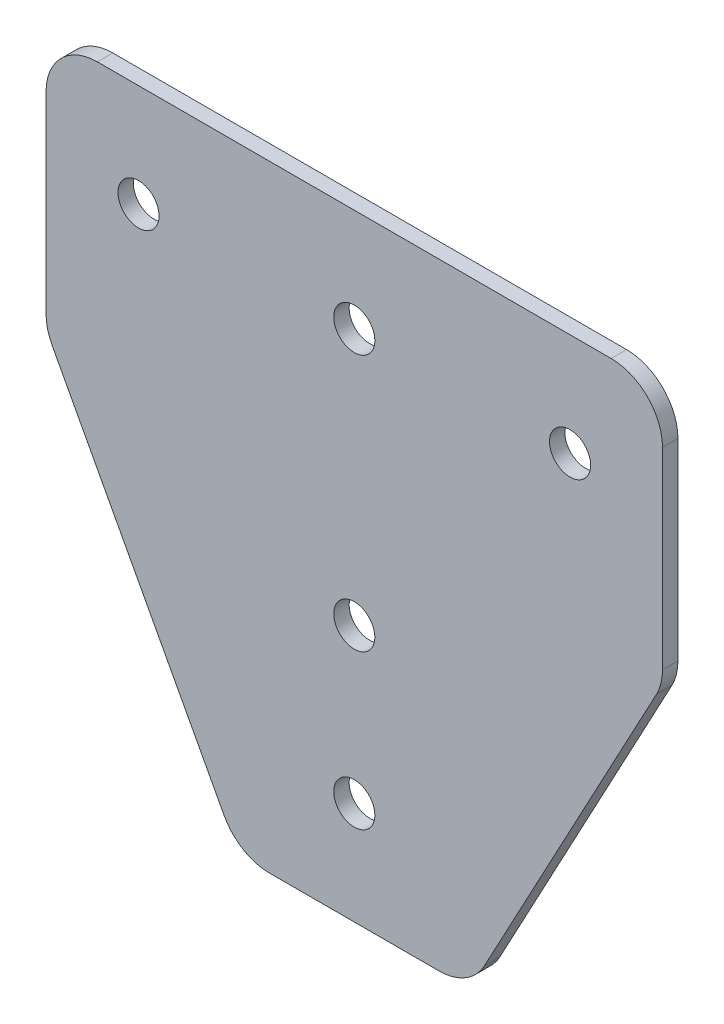
from build123d import *

# Parameters (mm, degrees)
SKETCH1_R           = 4
BOSS_EXTRUDE1_DEPTH = 3
FILLET1_R           = 10


with BuildPart() as part:
    # Sketch1 → Boss-Extrude1 (new body)
    with BuildSketch(Plane.XY):
        Polygon((-60, 60), (-60, 10), (-22.5, -60), (22.5, -60), (60, 10), (60, 60), align=None)
        with Locations((-42, 40)):
            Circle(SKETCH1_R, mode=Mode.SUBTRACT)
        with Locations((0, -40)):
            Circle(SKETCH1_R, mode=Mode.SUBTRACT)
        with Locations((0, -10)):
            Circle(SKETCH1_R, mode=Mode.SUBTRACT)
        with Locations((0, 40)):
            Circle(SKETCH1_R, mode=Mode.SUBTRACT)
        with Locations((42, 40)):
            Circle(SKETCH1_R, mode=Mode.SUBTRACT)
    extrude(amount=BOSS_EXTRUDE1_DEPTH)

    # Fillet1
    fillet1_edges = [part.edges().sort_by_distance(p)[0] for p in [
        (60, 60, 1.5),
        (60, 10, 1.5),
        (22.5, -60, 1.5),
        (-22.5, -60, 1.5),
        (-60, 10, 1.5),
        (-60, 60, 1.5),
    ]]
    fillet(fillet1_edges, radius=FILLET1_R)


solid = part.part
